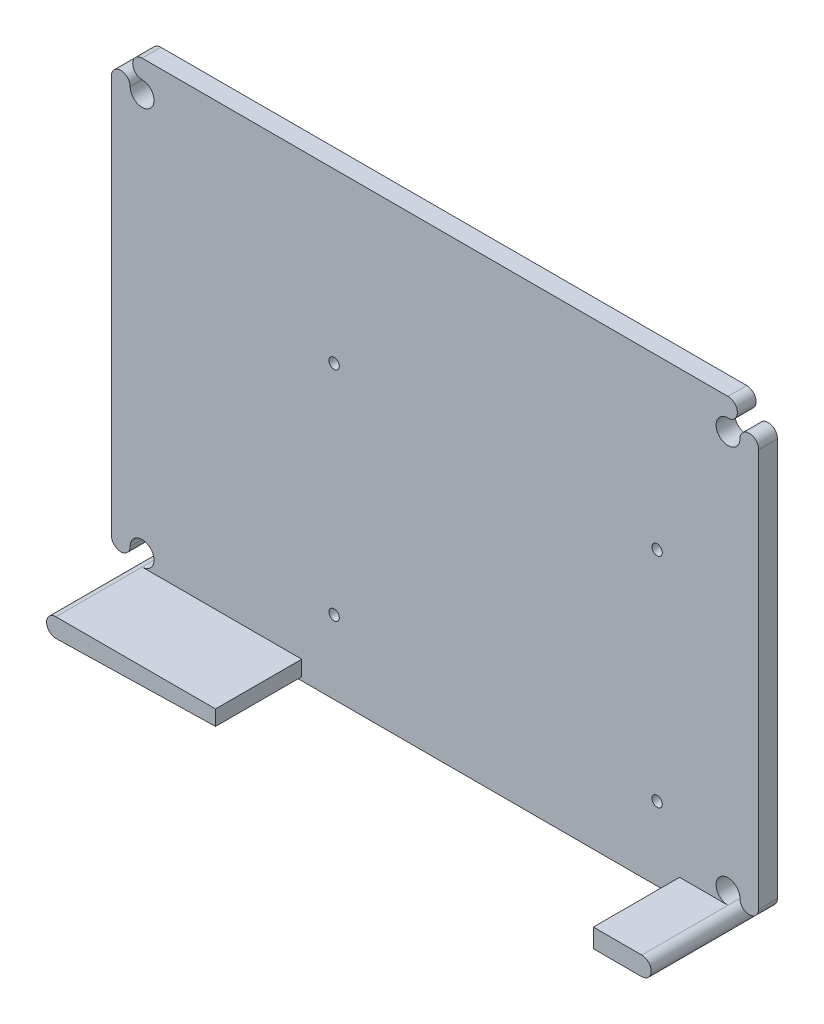
from build123d import *

# Parameters (mm, degrees)
RESSALTO_EXTRUS_O1_DEPTH = 5
RESSALTO_EXTRUS_O2_DEPTH = 22.95
ESBO_O3_R                = 1.38
CORTE_EXTRUS_O1_DEPTH    = 5


with BuildPart() as part:
    # Esboço1 → Ressalto-extrusão1 (new body)
    with BuildSketch(Plane.XY):
        with BuildLine():
            Line((-78, -61.175), (78, -61.175))
            ThreePointArc((78, -61.175), (80.5, -58.675), (78, -56.175))
            ThreePointArc((78, -56.175), (75.75493597, -50.75493597), (81.175, -53))
            ThreePointArc((81.175, -53), (83.675, -55.5), (86.175, -53))
            Line((86.175, -53), (86.175, 53))
            ThreePointArc((86.175, 53), (83.675, 55.5), (81.175, 53))
            ThreePointArc((81.175, 53), (75.756150129, 50.753722467), (77.996566768, 56.174998144))
            ThreePointArc((77.996566768, 56.174998144), (80.493861975, 58.677700014), (77.991160104, 61.174995221))
            Line((77.991160104, 61.174995221), (-78, 61.174995221))
            ThreePointArc((-78, 61.174995221), (-80.5, 58.674995221), (-78, 56.174995221))
            ThreePointArc((-78, 56.174995221), (-75.75493597, 50.75493119), (-81.175, 52.999995221))
            ThreePointArc((-81.175, 52.999995221), (-83.675, 55.499995221), (-86.175, 52.999995221))
            Line((-86.175, 52.999995221), (-86.175, -53))
            ThreePointArc((-86.175, -53), (-83.675, -55.5), (-81.175, -53))
            ThreePointArc((-81.175, -53), (-75.75493597, -50.75493597), (-78, -56.175))
            ThreePointArc((-78, -56.175), (-80.5, -58.675), (-78, -61.175))
        make_face()
    extrude(amount=RESSALTO_EXTRUS_O1_DEPTH)

    # Esboço2 → Ressalto-extrusão2 (add)
    with BuildSketch(Plane.XY.offset(5)):
        with BuildLine():
            Line((-78, -56.175), (-35.5, -56.175))
            Line((-35.5, -56.175), (-35.5, -60.212223694))
            Line((-35.5, -60.212223694), (-78, -61.175))
            ThreePointArc((-78, -61.175), (-80.5, -58.675), (-78, -56.175))
        make_face()
        with BuildLine():
            Line((78, -61.175), (65.099265532, -61.175))
            Line((65.099265532, -61.175), (65.099265532, -56.175))
            Line((65.099265532, -56.175), (78, -56.175))
            ThreePointArc((78, -56.175), (80.5, -58.675), (78, -61.175))
        make_face()
    extrude(amount=RESSALTO_EXTRUS_O2_DEPTH)

    # Esboço3 → Corte-extrusão1 (cut)
    with BuildSketch(Plane.XY.offset(5)):
        with Locations((59.125349465, -41.637776306)):
            Circle(ESBO_O3_R)
        with Locations((59.125349465, 16.362223694)):
            Circle(ESBO_O3_R)
        with Locations((-26.874650535, -41.637776306)):
            Circle(ESBO_O3_R)
        with Locations((-26.874650535, 16.362223694)):
            Circle(ESBO_O3_R)
    extrude(amount=-CORTE_EXTRUS_O1_DEPTH, mode=Mode.SUBTRACT)


solid = part.part
